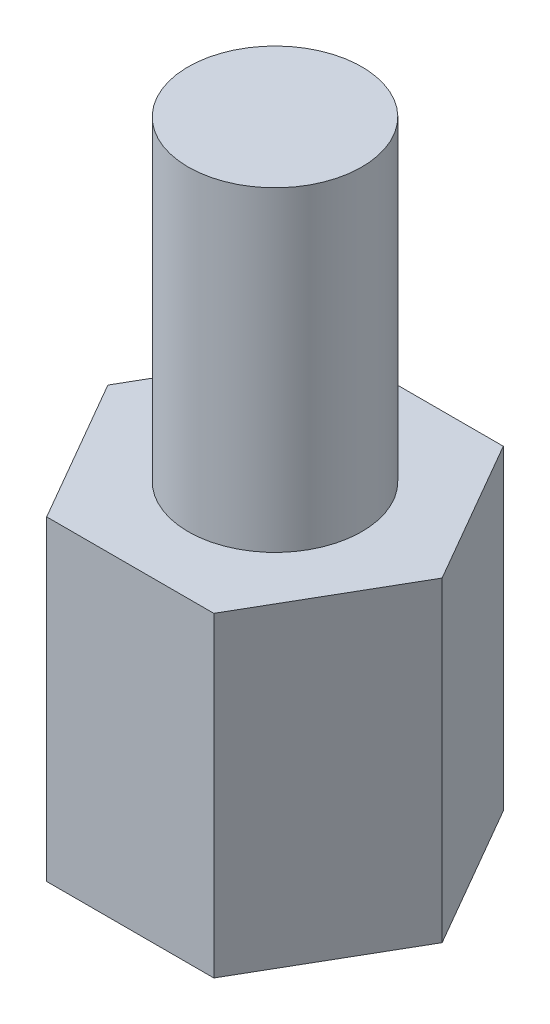
from build123d import *

# Parameters (mm, degrees)
SKETCH1_R           = 1.5
BOSS_EXTRUDE1_DEPTH = 6
SKETCH2_R           = 1.65
BOSS_EXTRUDE2_DEPTH = 6


with BuildPart() as part:
    # Sketch1 → Boss-Extrude1 (new body)
    with BuildSketch(Plane(origin=(0, 0, 0), x_dir=(1, 0, 0), z_dir=(0, 1, 0))):
        Polygon((1.58771324, 2.75), (-1.58771324, 2.75), (-3.175426481, 0), (-1.58771324, -2.75), (1.58771324, -2.75), (3.175426481, 0), align=None)
        with Locations(Location((0, 0, 0), (0, 0, 270))):
            Circle(SKETCH1_R, mode=Mode.SUBTRACT)
    extrude(amount=BOSS_EXTRUDE1_DEPTH)

    # Sketch2 → Boss-Extrude2 (add)
    with BuildSketch(Plane(origin=(0, 6, 0), x_dir=(1, 0, 0), z_dir=(0, 1, 0))):
        with Locations(Location((0, 0, 0), (0, 0, 270))):
            Circle(SKETCH2_R)
    extrude(amount=BOSS_EXTRUDE2_DEPTH)


solid = part.part
